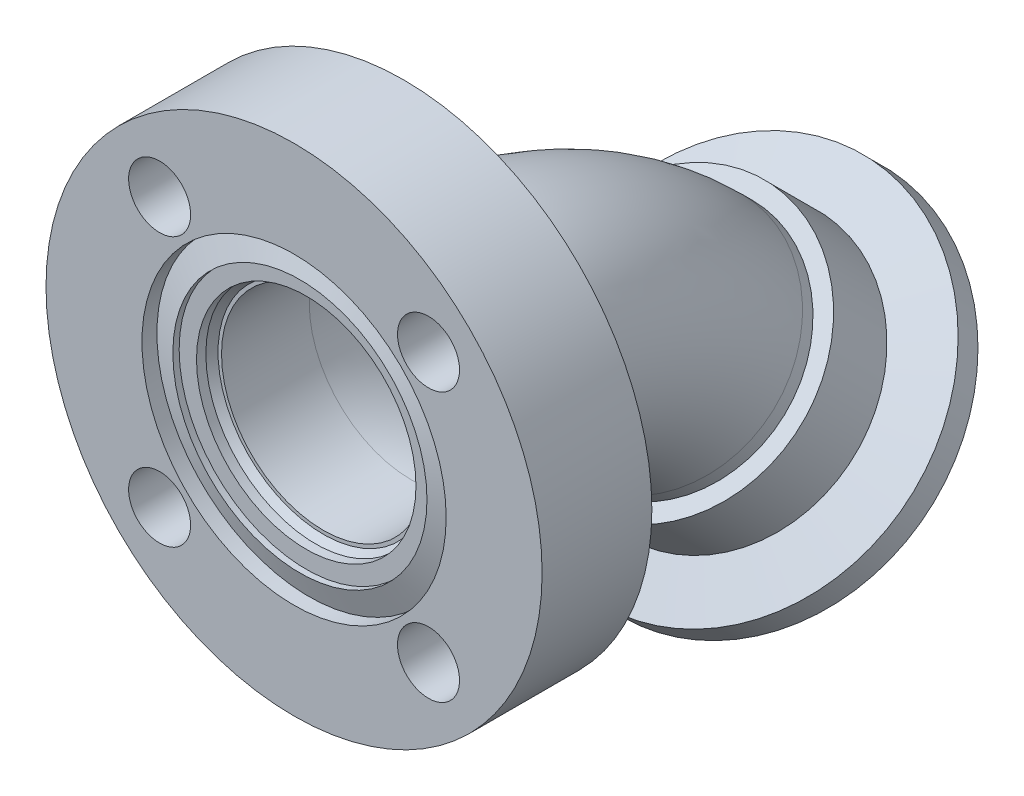
from build123d import *

# Parameters (mm, degrees)
SKETCH3_R          = 3.3655
CUT_EXTRUDE2_DEPTH = 40.896285426
CIRPATTERN1_COUNT  = 4
SKETCH6_R          = 12.7
SKETCH6_R_2        = 11.049


with BuildPart() as part:
    # Sketch1 → Revolve1 (revolve)
    with BuildSketch(Plane(origin=(0, 0, 0), x_dir=(0, 0, -1), z_dir=(1, 0, 0)), mode=Mode.PRIVATE) as revolve1_sk:
        Polygon((0, 26.924), (0, 16.51), (1.624198303, 16.51), (0.635, 13.7922), (1.3208, 13.7922), (1.3208, 11.9126), (2.3368, 11.9126), (3.722613851, 11.1125), (11.9126, 11.1125), (11.9126, 26.924), align=None)
    revolve(revolve1_sk.sketch.rotate(Axis((0, 0, 0), (0, 0, -1)), 90), axis=Axis((0, 0, 0), (0, 0, -1)))

    # Sketch3 → Cut-Extrude2 (cut, through all)
    with BuildSketch(Plane.XY):
        with Locations((14.593532367, 14.5923)):
            Circle(SKETCH3_R)
    cut_extrude2 = extrude(amount=-CUT_EXTRUDE2_DEPTH, mode=Mode.SUBTRACT)

    # CirPattern1: Cut-Extrude2 ×4 about axis
    cirpattern1_axis = Axis((0, 0, 0), (0, 0, 1))
    for i in range(1, CIRPATTERN1_COUNT):
        add(cut_extrude2.rotate(cirpattern1_axis, i * 360 / CIRPATTERN1_COUNT), mode=Mode.SUBTRACT)

    # Sweep2: sweep along a path in Sketch5
    with BuildLine(Plane(origin=(0, 0, 0), x_dir=(0, 0, -1), z_dir=(1, 0, 0))) as sweep2_path:
        Line((3.175, 0), (12.7, 0))
        ThreePointArc((12.7, 0), (27.280238773, -2.900189811), (39.640768363, -11.159231637))
        Line((39.640768363, -11.159231637), (46.375960454, -17.894423728))
    # Sketch6 → Sweep2 (sweep)
    with BuildSketch(Plane.XY.offset(-3.175)):
        Circle(SKETCH6_R)
        Circle(SKETCH6_R_2, mode=Mode.SUBTRACT)
    sweep(path=sweep2_path.line)

    # Sketch7 → Revolve2 (revolve)
    with BuildSketch(Plane(origin=(0, 0, 0), x_dir=(0, 0, -1), z_dir=(1, 0, 0)), mode=Mode.PRIVATE) as revolve2_sk:
        Polygon((56.431890618, -10.999543718), (57.224109848, -10.207324488), (59.020161072, -12.003375712), (63.88745989, -7.136076895), (61.732198421, -4.980815425), (56.833518782, -7.809069434), (51.043736945, -2.019287597), (49.247685721, -3.815338821), align=None)
    revolve(revolve2_sk.sketch.rotate(Axis((0, -17.894423728, -46.375960454), (0, -0.7071067811865475, -0.7071067811865476)), 180), axis=Axis((0, -17.894423728, -46.375960454), (0, -0.7071067811865475, -0.7071067811865476)))


solid = part.part
